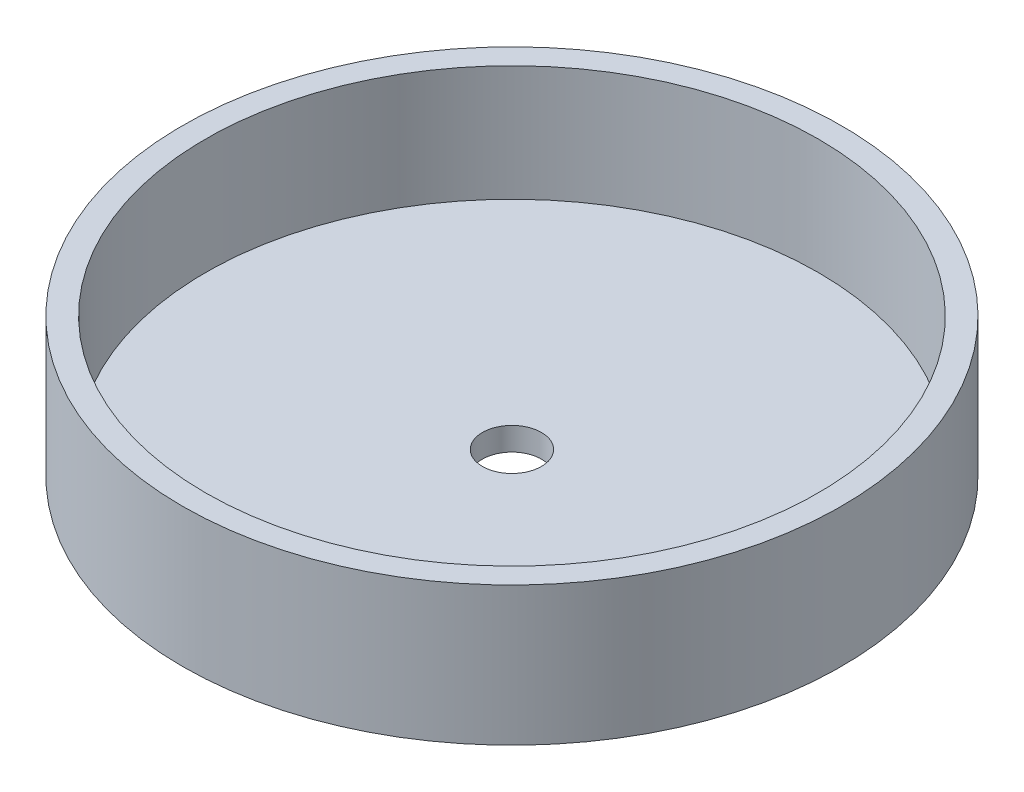
from build123d import *


with BuildPart() as part:
    # 草图1 → 旋转1 (revolve)
    with BuildSketch(Plane.XY, mode=Mode.PRIVATE) as revolve_1_sk:
        Polygon((2.55, 0), (26.5, 0), (26.5, 10), (28.5, 10), (28.5, -2), (4.55, -2), (2.55, -2), align=None)
    revolve(revolve_1_sk.sketch.rotate(Axis((0, 9.946236559, 0), (0, -1, 0)), 90), axis=Axis((0, 9.946236559, 0), (0, -1, 0)))


solid = part.part
